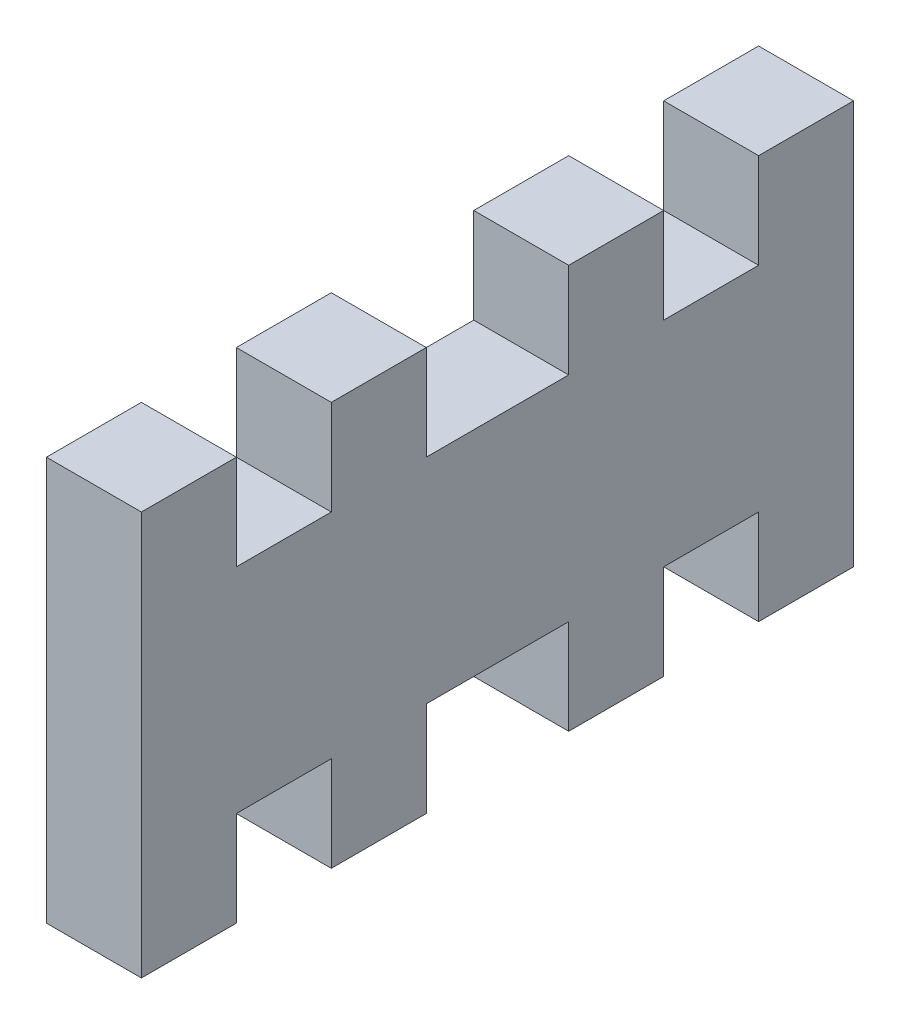
from build123d import *

# Parameters (mm, degrees)
SKETCH1_W           = 38.1
SKETCH1_H           = 11.43
BOSS_EXTRUDE1_DEPTH = 5.08
SKETCH2_W           = 5.08
SKETCH2_H           = 5.08
BOSS_EXTRUDE2_DEPTH = 5.08


with BuildPart() as part:
    # Sketch1 → Boss-Extrude1 (new body)
    with BuildSketch(Plane(origin=(0, 0, 0), x_dir=(0, 0, -1), z_dir=(1, 0, 0))):
        with Locations((5.391509434, 10.010235849)):
            Rectangle(SKETCH1_W, SKETCH1_H)
    extrude(amount=BOSS_EXTRUDE1_DEPTH)

    # Sketch2 → Boss-Extrude2 (add)
    with BuildSketch(Plane(origin=(5.08, 0, 0), x_dir=(0, 0, -1), z_dir=(1, 0, 0))):
        with Locations((-11.118490566, 18.265235849)):
            Rectangle(SKETCH2_W, SKETCH2_H)
        with Locations((11.741509434, 18.265235849)):
            Rectangle(SKETCH2_W, SKETCH2_H)
        with Locations((21.901509434, 18.265235849)):
            Rectangle(SKETCH2_W, SKETCH2_H)
        with Locations((-0.958490566, 18.265235849)):
            Rectangle(SKETCH2_W, SKETCH2_H)
        with Locations((-0.958490566, 1.755235849)):
            Rectangle(SKETCH2_W, SKETCH2_H)
        with Locations((-11.118490566, 1.755235849)):
            Rectangle(SKETCH2_W, SKETCH2_H)
        with Locations((21.901509434, 1.755235849)):
            Rectangle(SKETCH2_W, SKETCH2_H)
        with Locations((11.741509434, 1.755235849)):
            Rectangle(SKETCH2_W, SKETCH2_H)
    extrude(amount=-BOSS_EXTRUDE2_DEPTH)


solid = part.part
